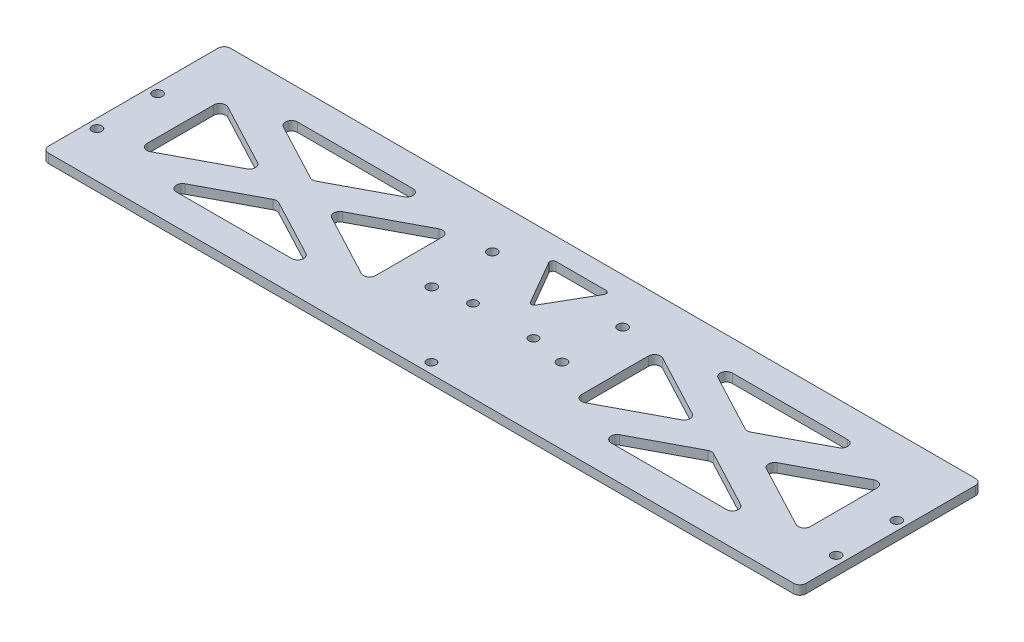
from build123d import *

# Parameters (mm, degrees)
SKETCH_1_W             = 250
SKETCH_1_H             = 60
EXTRUDE_1_DEPTH        = 3
SKETCH_2_R             = 1.5
CUT_EXTRUDE_1_DEPTH    = 129.5846025
SKETCH_3_R             = 1.6
CUT_EXTRUDE_2_DEPTH    = 129.5846025
SKETCH_4_R             = 1.6
CUT_EXTRUDE_3_DEPTH    = 129.5846025
FILLET_1_R             = 2
CUT_EXTRUDE_4_DEPTH    = 129.5846025
FILLET_2_R             = 2
FILLET_2_OF_MIRROR_1_R = 2
CUT_EXTRUDE_5_DEPTH    = 129.5846025
FILLET_3_R             = 1


with BuildPart() as part:
    # 草图1 → 凸台-拉伸1 (new body)
    with BuildSketch(Plane(origin=(0, 0, 0), x_dir=(1, 0, 0), z_dir=(0, 1, 0))):
        Rectangle(SKETCH_1_W, SKETCH_1_H)
    extrude(amount=EXTRUDE_1_DEPTH)

    # 草图2 → 切除-拉伸1 (cut, through all)
    with BuildSketch(Plane(origin=(0, 3, 0), x_dir=(1, 0, 0), z_dir=(0, 1, 0))):
        with Locations(Location((0, -26.6, 0), (0, 0, 270))):
            Circle(SKETCH_2_R)
        with Locations(Location((10, -2.9, 0), (0, 0, 270))):
            Circle(SKETCH_2_R)
        with Locations(Location((-10, -2.9, 0), (0, 0, 270))):
            Circle(SKETCH_2_R)
    extrude(amount=-CUT_EXTRUDE_1_DEPTH, mode=Mode.SUBTRACT)

    # 草图3 → 切除-拉伸2 (cut, through all)
    with BuildSketch(Plane.XZ):
        with Locations(Location((122, 15, 0), (0, 0, 270))):
            Circle(SKETCH_3_R)
        with Locations(Location((122, -5, 0), (0, 0, 270))):
            Circle(SKETCH_3_R)
        with Locations(Location((-122, 15, 0), (0, 0, 270))):
            Circle(SKETCH_3_R)
        with Locations(Location((-122, -5, 0), (0, 0, 270))):
            Circle(SKETCH_3_R)
    extrude(amount=-CUT_EXTRUDE_2_DEPTH, mode=Mode.SUBTRACT)

    # 草图4 → 切除-拉伸3 (cut, through all)
    with BuildSketch(Plane(origin=(0, 3, 0), x_dir=(1, 0, 0), z_dir=(0, 1, 0))):
        with Locations(Location((-21.5, -5, 0), (0, 0, 270))):
            Circle(SKETCH_4_R)
        with Locations(Location((-21.5, 15, 0), (0, 0, 270))):
            Circle(SKETCH_4_R)
        with Locations(Location((21.5, -5, 0), (0, 0, 270))):
            Circle(SKETCH_4_R)
        with Locations(Location((21.5, 15, 0), (0, 0, 270))):
            Circle(SKETCH_4_R)
    extrude(amount=-CUT_EXTRUDE_3_DEPTH, mode=Mode.SUBTRACT)

    # 圆角1
    fillet_1_edges = [part.edges().sort_by_distance(p)[0] for p in [
        (125, 1.5, 30),
        (-125, 1.5, 30),
        (-125, 1.5, -30),
        (125, 1.5, -30),
    ]]
    fillet(fillet_1_edges, radius=FILLET_1_R)

    # 草图5 → 切除-拉伸4 (cut, through all)
    with BuildSketch(Plane(origin=(0, 3, 0), x_dir=(1, 0, 0), z_dir=(0, 1, 0))):
        Polygon((-44.680187557, 20), (-98.819812443, 20), (-71.75, 5.658377514), align=None)
        Polygon((-34, -14.341622486), (-34, 14.341622486), (-61.069812443, 0), align=None)
        Polygon((-71.75, -5.658377514), (-98.819812443, -20), (-44.680187557, -20), align=None)
        Polygon((-82.430187557, 0), (-109.5, 14.341622486), (-109.5, -14.341622486), align=None)
    cut_extrude_4 = extrude(amount=-CUT_EXTRUDE_4_DEPTH, mode=Mode.SUBTRACT)

    # 圆角2
    fillet_2_edges = [part.edges().sort_by_distance(p)[0] for p in [
        (-71.75, 1.5, 5.658377514),
        (-44.680187557, 1.5, 20),
        (-98.819812443, 1.5, 20),
        (-61.069812443, 1.5, 0),
        (-34, 1.5, -14.341622486),
        (-34, 1.5, 14.341622486),
        (-109.5, 1.5, -14.341622486),
        (-82.430187557, 1.5, 0),
        (-109.5, 1.5, 14.341622486),
        (-98.819812443, 1.5, -20),
        (-44.680187557, 1.5, -20),
        (-71.75, 1.5, -5.658377514),
    ]]
    fillet(fillet_2_edges, radius=FILLET_2_R)

    # 镜向1: 切除-拉伸4 across plane
    add(cut_extrude_4.mirror(Plane.ZY), mode=Mode.SUBTRACT)

    # 圆角2 of 镜向1
    fillet_2_of_mirror_1_edges = [part.edges().sort_by_distance(p)[0] for p in [
        (71.75, 1.5, 5.658377514),
        (44.680187557, 1.5, 20),
        (98.819812443, 1.5, 20),
        (61.069812443, 1.5, 0),
        (34, 1.5, -14.341622486),
        (34, 1.5, 14.341622486),
        (109.5, 1.5, -14.341622486),
        (82.430187557, 1.5, 0),
        (109.5, 1.5, 14.341622486),
        (98.819812443, 1.5, -20),
        (44.680187557, 1.5, -20),
        (71.75, 1.5, -5.658377514),
    ]]
    fillet(fillet_2_of_mirror_1_edges, radius=FILLET_2_OF_MIRROR_1_R)

    # 草图6 → 切除-拉伸5 (cut, through all)
    with BuildSketch(Plane(origin=(0, 3, 0), x_dir=(1, 0, 0), z_dir=(0, 1, 0))):
        Polygon((0, 5.452994616), (10, 22.773502692), (-10, 22.773502692), align=None)
    extrude(amount=-CUT_EXTRUDE_5_DEPTH, mode=Mode.SUBTRACT)

    # 圆角3
    fillet_3_edges = [part.edges().sort_by_distance(p)[0] for p in [
        (0, 1.5, -5.452994616),
        (-10, 1.5, -22.773502692),
        (10, 1.5, -22.773502692),
    ]]
    fillet(fillet_3_edges, radius=FILLET_3_R)


solid = part.part
